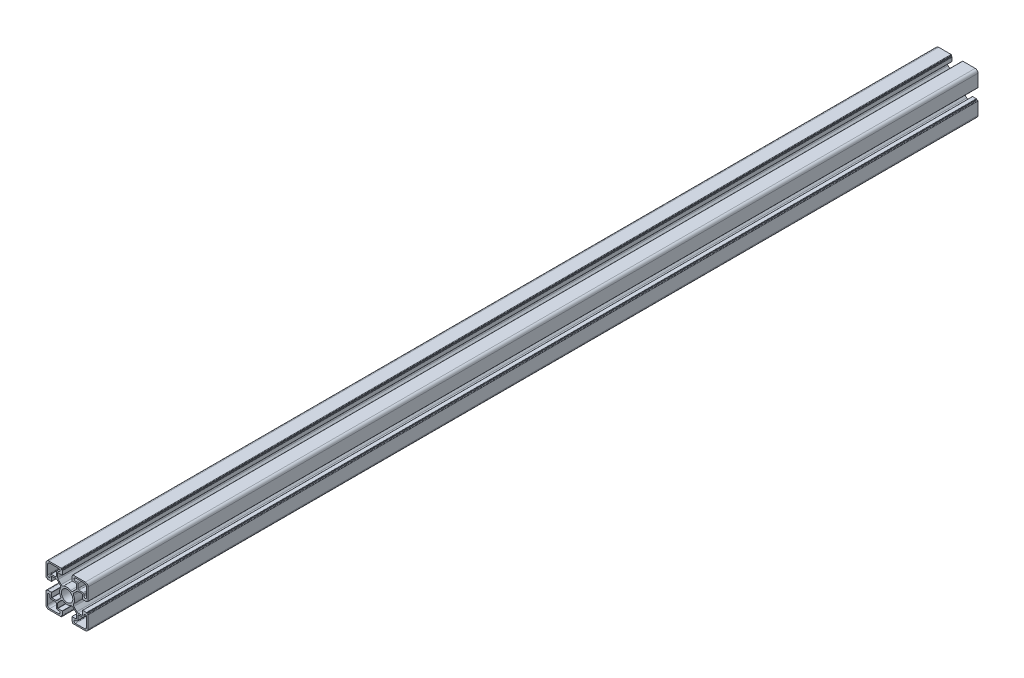
from build123d import *

# Parameters (mm, degrees)
BOSS_EXTRUDE1_DEPTH = 950
SCALE1_SCALE        = 0.5644444


with BuildPart() as part:
    # Sketch1 → Boss-Extrude1 (new body)
    with BuildSketch(Plane.XY):
        with BuildLine():
            Line((-22.5, 19.5), (-22.5, 6.3))
            ThreePointArc((-22.5, 6.3), (-22.353553391, 5.946446609), (-22, 5.8))
            Line((-22, 5.8), (-21.3, 5.8))
            ThreePointArc((-21.3, 5.8), (-21.087867966, 5.712132034), (-21, 5.5))
            Line((-21, 5.5), (-21, 5.3))
            ThreePointArc((-21, 5.3), (-20.912132034, 5.087867966), (-20.7, 5))
            Line((-20.7, 5), (-16.7, 5))
            ThreePointArc((-16.7, 5), (-16.558578644, 5.058578644), (-16.5, 5.2))
            Line((-16.5, 5.2), (-16.5, 9.8))
            ThreePointArc((-16.5, 9.8), (-16.441421356, 9.941421356), (-16.3, 10))
            Line((-16.3, 10), (-11.864234483, 10))
            ThreePointArc((-11.864234483, 10), (-11.121828624, 9.852326293), (-10.492447327, 9.431787156))
            Line((-10.492447327, 9.431787156), (-7.296699127, 6.236038955))
            ThreePointArc((-7.296699127, 6.236038955), (-6.746669172, 5.129240469), (-6.976648919, 3.914890784))
            ThreePointArc((-6.976648919, 3.914890784), (-7.739935121, 2.023216331), (-8, 0))
            ThreePointArc((-8, 0), (-7.739935121, -2.023216331), (-6.976648919, -3.914890784))
            ThreePointArc((-6.976648919, -3.914890784), (-6.746669172, -5.129240469), (-7.296699127, -6.236038955))
            Line((-7.296699127, -6.236038955), (-10.492447327, -9.431787156))
            ThreePointArc((-10.492447327, -9.431787156), (-11.121828624, -9.852326293), (-11.864234483, -10))
            Line((-11.864234483, -10), (-16.3, -10))
            ThreePointArc((-16.3, -10), (-16.441421356, -9.941421356), (-16.5, -9.8))
            Line((-16.5, -9.8), (-16.5, -5.2))
            ThreePointArc((-16.5, -5.2), (-16.558578644, -5.058578644), (-16.7, -5))
            Line((-16.7, -5), (-20.7, -5))
            ThreePointArc((-20.7, -5), (-20.912132034, -5.087867966), (-21, -5.3))
            Line((-21, -5.3), (-21, -5.5))
            ThreePointArc((-21, -5.5), (-21.087867966, -5.712132034), (-21.3, -5.8))
            Line((-21.3, -5.8), (-22, -5.8))
            ThreePointArc((-22, -5.8), (-22.353553391, -5.946446609), (-22.5, -6.3))
            Line((-22.5, -6.3), (-22.5, -19.5))
            ThreePointArc((-22.5, -19.5), (-21.621320344, -21.621320344), (-19.5, -22.5))
            Line((-19.5, -22.5), (-6.3, -22.5))
            ThreePointArc((-6.3, -22.5), (-5.946446609, -22.353553391), (-5.8, -22))
            Line((-5.8, -22), (-5.8, -21.3))
            ThreePointArc((-5.8, -21.3), (-5.712132034, -21.087867966), (-5.5, -21))
            Line((-5.5, -21), (-5.3, -21))
            ThreePointArc((-5.3, -21), (-5.087867966, -20.912132034), (-5, -20.7))
            Line((-5, -20.7), (-5, -16.7))
            ThreePointArc((-5, -16.7), (-5.058578644, -16.558578644), (-5.2, -16.5))
            Line((-5.2, -16.5), (-9.8, -16.5))
            ThreePointArc((-9.8, -16.5), (-9.941421356, -16.441421356), (-10, -16.3))
            Line((-10, -16.3), (-10, -11.864234483))
            ThreePointArc((-10, -11.864234483), (-9.852326293, -11.121828624), (-9.431787156, -10.492447327))
            Line((-9.431787156, -10.492447327), (-6.236038955, -7.296699127))
            ThreePointArc((-6.236038955, -7.296699127), (-5.129240469, -6.746669172), (-3.914890784, -6.976648919))
            ThreePointArc((-3.914890784, -6.976648919), (-2.023216331, -7.739935121), (0, -8))
            ThreePointArc((0, -8), (2.023216331, -7.739935121), (3.914890784, -6.976648919))
            ThreePointArc((3.914890784, -6.976648919), (5.129240469, -6.746669172), (6.236038955, -7.296699127))
            Line((6.236038955, -7.296699127), (9.431787156, -10.492447327))
            ThreePointArc((9.431787156, -10.492447327), (9.852326293, -11.121828624), (10, -11.864234483))
            Line((10, -11.864234483), (10, -16.3))
            ThreePointArc((10, -16.3), (9.941421356, -16.441421356), (9.8, -16.5))
            Line((9.8, -16.5), (5.2, -16.5))
            ThreePointArc((5.2, -16.5), (5.058578644, -16.558578644), (5, -16.7))
            Line((5, -16.7), (5, -20.7))
            ThreePointArc((5, -20.7), (5.087867966, -20.912132034), (5.3, -21))
            Line((5.3, -21), (5.5, -21))
            ThreePointArc((5.5, -21), (5.712132034, -21.087867966), (5.8, -21.3))
            Line((5.8, -21.3), (5.8, -22))
            ThreePointArc((5.8, -22), (5.946446609, -22.353553391), (6.3, -22.5))
            Line((6.3, -22.5), (19.5, -22.5))
            ThreePointArc((19.5, -22.5), (21.621320344, -21.621320344), (22.5, -19.5))
            Line((22.5, -19.5), (22.5, -6.3))
            ThreePointArc((22.5, -6.3), (22.353553391, -5.946446609), (22, -5.8))
            Line((22, -5.8), (21.3, -5.8))
            ThreePointArc((21.3, -5.8), (21.087867966, -5.712132034), (21, -5.5))
            Line((21, -5.5), (21, -5.3))
            ThreePointArc((21, -5.3), (20.912132034, -5.087867966), (20.7, -5))
            Line((20.7, -5), (16.7, -5))
            ThreePointArc((16.7, -5), (16.558578644, -5.058578644), (16.5, -5.2))
            Line((16.5, -5.2), (16.5, -9.8))
            ThreePointArc((16.5, -9.8), (16.441421356, -9.941421356), (16.3, -10))
            Line((16.3, -10), (11.864234483, -10))
            ThreePointArc((11.864234483, -10), (11.121828624, -9.852326293), (10.492447327, -9.431787156))
            Line((10.492447327, -9.431787156), (7.296699127, -6.236038955))
            ThreePointArc((7.296699127, -6.236038955), (6.746669172, -5.129240469), (6.976648919, -3.914890784))
            ThreePointArc((6.976648919, -3.914890784), (7.739935121, -2.023216331), (8, 0))
            ThreePointArc((8, 0), (7.739935121, 2.023216331), (6.976648919, 3.914890784))
            ThreePointArc((6.976648919, 3.914890784), (6.746669172, 5.129240469), (7.296699127, 6.236038955))
            Line((7.296699127, 6.236038955), (10.492447327, 9.431787156))
            ThreePointArc((10.492447327, 9.431787156), (11.121828624, 9.852326293), (11.864234483, 10))
            Line((11.864234483, 10), (16.3, 10))
            ThreePointArc((16.3, 10), (16.441421356, 9.941421356), (16.5, 9.8))
            Line((16.5, 9.8), (16.5, 5.2))
            ThreePointArc((16.5, 5.2), (16.558578644, 5.058578644), (16.7, 5))
            Line((16.7, 5), (20.7, 5))
            ThreePointArc((20.7, 5), (20.912132034, 5.087867966), (21, 5.3))
            Line((21, 5.3), (21, 5.5))
            ThreePointArc((21, 5.5), (21.087867966, 5.712132034), (21.3, 5.8))
            Line((21.3, 5.8), (22, 5.8))
            ThreePointArc((22, 5.8), (22.353553391, 5.946446609), (22.5, 6.3))
            Line((22.5, 6.3), (22.5, 19.5))
            ThreePointArc((22.5, 19.5), (21.621320344, 21.621320344), (19.5, 22.5))
            Line((19.5, 22.5), (6.3, 22.5))
            ThreePointArc((6.3, 22.5), (5.946446609, 22.353553391), (5.8, 22))
            Line((5.8, 22), (5.8, 21.3))
            ThreePointArc((5.8, 21.3), (5.712132034, 21.087867966), (5.5, 21))
            Line((5.5, 21), (5.3, 21))
            ThreePointArc((5.3, 21), (5.087867966, 20.912132034), (5, 20.7))
            Line((5, 20.7), (5, 16.7))
            ThreePointArc((5, 16.7), (5.058578644, 16.558578644), (5.2, 16.5))
            Line((5.2, 16.5), (9.8, 16.5))
            ThreePointArc((9.8, 16.5), (9.941421356, 16.441421356), (10, 16.3))
            Line((10, 16.3), (10, 11.864234483))
            ThreePointArc((10, 11.864234483), (9.852326293, 11.121828624), (9.431787156, 10.492447327))
            Line((9.431787156, 10.492447327), (6.236038955, 7.296699127))
            ThreePointArc((6.236038955, 7.296699127), (5.129240469, 6.746669172), (3.914890784, 6.976648919))
            ThreePointArc((3.914890784, 6.976648919), (2.023216331, 7.739935121), (0, 8))
            ThreePointArc((0, 8), (-2.023216331, 7.739935121), (-3.914890784, 6.976648919))
            ThreePointArc((-3.914890784, 6.976648919), (-5.129240469, 6.746669172), (-6.236038955, 7.296699127))
            Line((-6.236038955, 7.296699127), (-9.431787156, 10.492447327))
            ThreePointArc((-9.431787156, 10.492447327), (-9.852326293, 11.121828624), (-10, 11.864234483))
            Line((-10, 11.864234483), (-10, 16.3))
            ThreePointArc((-10, 16.3), (-9.941421356, 16.441421356), (-9.8, 16.5))
            Line((-9.8, 16.5), (-5.2, 16.5))
            ThreePointArc((-5.2, 16.5), (-5.058578644, 16.558578644), (-5, 16.7))
            Line((-5, 16.7), (-5, 20.7))
            ThreePointArc((-5, 20.7), (-5.087867966, 20.912132034), (-5.3, 21))
            Line((-5.3, 21), (-5.5, 21))
            ThreePointArc((-5.5, 21), (-5.712132034, 21.087867966), (-5.8, 21.3))
            Line((-5.8, 21.3), (-5.8, 22))
            ThreePointArc((-5.8, 22), (-5.946446609, 22.353553391), (-6.3, 22.5))
            Line((-6.3, 22.5), (-19.5, 22.5))
            ThreePointArc((-19.5, 22.5), (-21.621320344, 21.621320344), (-22.5, 19.5))
        make_face()
        with BuildLine():
            Line((-21, 18.5), (-21, 9))
            ThreePointArc((-21, 9), (-19.5, 7.5), (-18, 9))
            Line((-18, 9), (-18, 10.5))
            ThreePointArc((-18, 10.5), (-17.707106781, 11.207106781), (-17, 11.5))
            Line((-17, 11.5), (-12.5, 11.5))
            ThreePointArc((-12.5, 11.5), (-11.792893219, 11.792893219), (-11.5, 12.5))
            Line((-11.5, 12.5), (-11.5, 17))
            ThreePointArc((-11.5, 17), (-11.207106781, 17.707106781), (-10.5, 18))
            Line((-10.5, 18), (-9, 18))
            ThreePointArc((-9, 18), (-7.5, 19.5), (-9, 21))
            Line((-9, 21), (-18.5, 21))
            ThreePointArc((-18.5, 21), (-20.267766953, 20.267766953), (-21, 18.5))
        make_face(mode=Mode.SUBTRACT)
        with BuildLine():
            Line((18.5, 21), (9, 21))
            ThreePointArc((9, 21), (7.5, 19.5), (9, 18))
            Line((9, 18), (10.5, 18))
            ThreePointArc((10.5, 18), (11.207106781, 17.707106781), (11.5, 17))
            Line((11.5, 17), (11.5, 12.5))
            ThreePointArc((11.5, 12.5), (11.792893219, 11.792893219), (12.5, 11.5))
            Line((12.5, 11.5), (17, 11.5))
            ThreePointArc((17, 11.5), (17.707106781, 11.207106781), (18, 10.5))
            Line((18, 10.5), (18, 9))
            ThreePointArc((18, 9), (19.5, 7.5), (21, 9))
            Line((21, 9), (21, 18.5))
            ThreePointArc((21, 18.5), (20.267766953, 20.267766953), (18.5, 21))
        make_face(mode=Mode.SUBTRACT)
        with BuildLine():
            Line((21, -18.5), (21, -9))
            ThreePointArc((21, -9), (19.5, -7.5), (18, -9))
            Line((18, -9), (18, -10.5))
            ThreePointArc((18, -10.5), (17.707106781, -11.207106781), (17, -11.5))
            Line((17, -11.5), (12.5, -11.5))
            ThreePointArc((12.5, -11.5), (11.792893219, -11.792893219), (11.5, -12.5))
            Line((11.5, -12.5), (11.5, -17))
            ThreePointArc((11.5, -17), (11.207106781, -17.707106781), (10.5, -18))
            Line((10.5, -18), (9, -18))
            ThreePointArc((9, -18), (7.5, -19.5), (9, -21))
            Line((9, -21), (18.5, -21))
            ThreePointArc((18.5, -21), (20.267766953, -20.267766953), (21, -18.5))
        make_face(mode=Mode.SUBTRACT)
        with BuildLine():
            Line((-18.5, -21), (-9, -21))
            ThreePointArc((-9, -21), (-7.5, -19.5), (-9, -18))
            Line((-9, -18), (-10.5, -18))
            ThreePointArc((-10.5, -18), (-11.207106781, -17.707106781), (-11.5, -17))
            Line((-11.5, -17), (-11.5, -12.5))
            ThreePointArc((-11.5, -12.5), (-11.792893219, -11.792893219), (-12.5, -11.5))
            Line((-12.5, -11.5), (-17, -11.5))
            ThreePointArc((-17, -11.5), (-17.707106781, -11.207106781), (-18, -10.5))
            Line((-18, -10.5), (-18, -9))
            ThreePointArc((-18, -9), (-19.5, -7.5), (-21, -9))
            Line((-21, -9), (-21, -18.5))
            ThreePointArc((-21, -18.5), (-20.267766953, -20.267766953), (-18.5, -21))
        make_face(mode=Mode.SUBTRACT)
        with BuildLine():
            ThreePointArc((0, 6.1), (-4.313351365, 4.313351365), (-6.1, 0))
            ThreePointArc((-6.1, 0), (-4.313351365, -4.313351365), (0, -6.1))
            ThreePointArc((0, -6.1), (4.313351365, -4.313351365), (6.1, 0))
            ThreePointArc((6.1, 0), (4.313351365, 4.313351365), (0, 6.1))
        make_face(mode=Mode.SUBTRACT)
    extrude(amount=BOSS_EXTRUDE1_DEPTH)


with BuildPart() as part_1:
    # Scale1: scaled about (0, 0, 475)
    add(part.part.scale(SCALE1_SCALE).moved(Location((0, 0, 206.88891))))


solid = part_1.part
